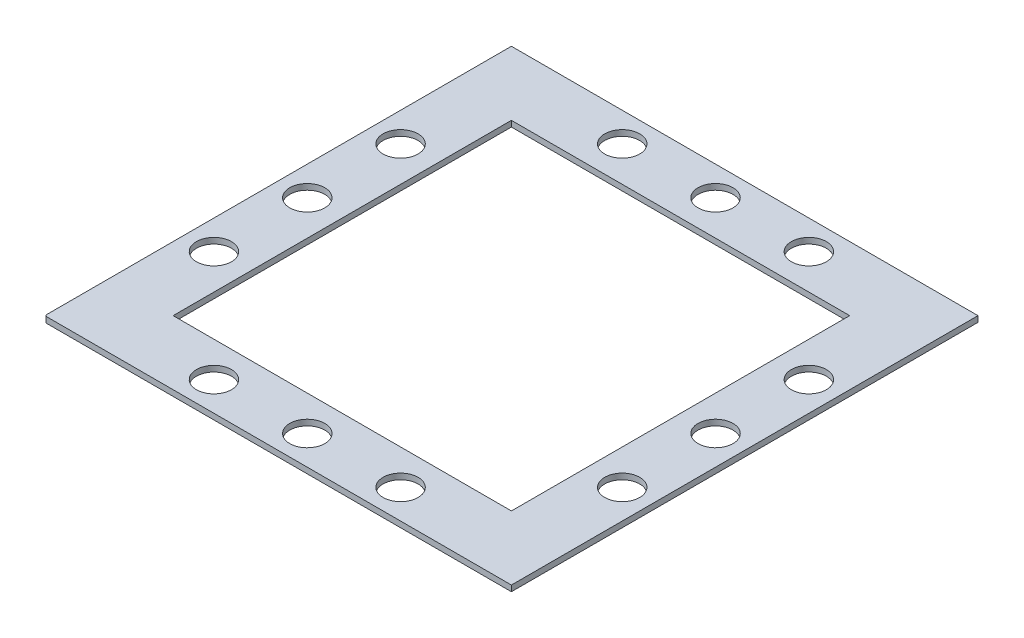
from build123d import *

# Parameters (mm, degrees)
CROQUIS1_R              = 1.5
CROQUIS1_W              = 29
CROQUIS1_H              = 29
SALIENTE_EXTRUIR1_DEPTH = 0.5


with BuildPart() as part:
    # Croquis1 → Saliente-Extruir1 (new body)
    with BuildSketch(Plane(origin=(0, 0, 0), x_dir=(1, 0, 0), z_dir=(0, 1, 0))):
        with BuildLine():
            ThreePointArc((-5.5, -5.381384118), (-5.449888151, -5.441258419), (-5.398453182, -5.5))
            Line((-5.398453182, -5.5), (34.5, -5.5))
            Line((34.5, -5.5), (34.5, 34.5))
            Line((34.5, 34.5), (-5.5, 34.5))
            Line((-5.5, 34.5), (-5.5, -5.381384118))
        make_face()
        with Locations(Location((6.5, -3, 0), (0, 0, 270))):
            Circle(CROQUIS1_R, mode=Mode.SUBTRACT)
        with Locations(Location((-3, 6.5, 0), (0, 0, 270))):
            Circle(CROQUIS1_R, mode=Mode.SUBTRACT)
        with Locations((14.5, 14.5)):
            Rectangle(CROQUIS1_W, CROQUIS1_H, mode=Mode.SUBTRACT)
        with Locations(Location((14.5, -3, 0), (0, 0, 270))):
            Circle(CROQUIS1_R, mode=Mode.SUBTRACT)
        with Locations(Location((22.5, -3, 0), (0, 0, 270))):
            Circle(CROQUIS1_R, mode=Mode.SUBTRACT)
        with Locations(Location((32, 6.5, 0), (0, 0, 270))):
            Circle(CROQUIS1_R, mode=Mode.SUBTRACT)
        with Locations(Location((32, 14.5, 0), (0, 0, 270))):
            Circle(CROQUIS1_R, mode=Mode.SUBTRACT)
        with Locations(Location((-3, 14.5, 0), (0, 0, 270))):
            Circle(CROQUIS1_R, mode=Mode.SUBTRACT)
        with Locations(Location((-3, 22.5, 0), (0, 0, 270))):
            Circle(CROQUIS1_R, mode=Mode.SUBTRACT)
        with Locations(Location((6.5, 32, 0), (0, 0, 270))):
            Circle(CROQUIS1_R, mode=Mode.SUBTRACT)
        with Locations(Location((32, 22.5, 0), (0, 0, 270))):
            Circle(CROQUIS1_R, mode=Mode.SUBTRACT)
        with Locations(Location((14.5, 32, 0), (0, 0, 270))):
            Circle(CROQUIS1_R, mode=Mode.SUBTRACT)
        with Locations(Location((22.5, 32, 0), (0, 0, 270))):
            Circle(CROQUIS1_R, mode=Mode.SUBTRACT)
    extrude(amount=SALIENTE_EXTRUIR1_DEPTH)


solid = part.part
